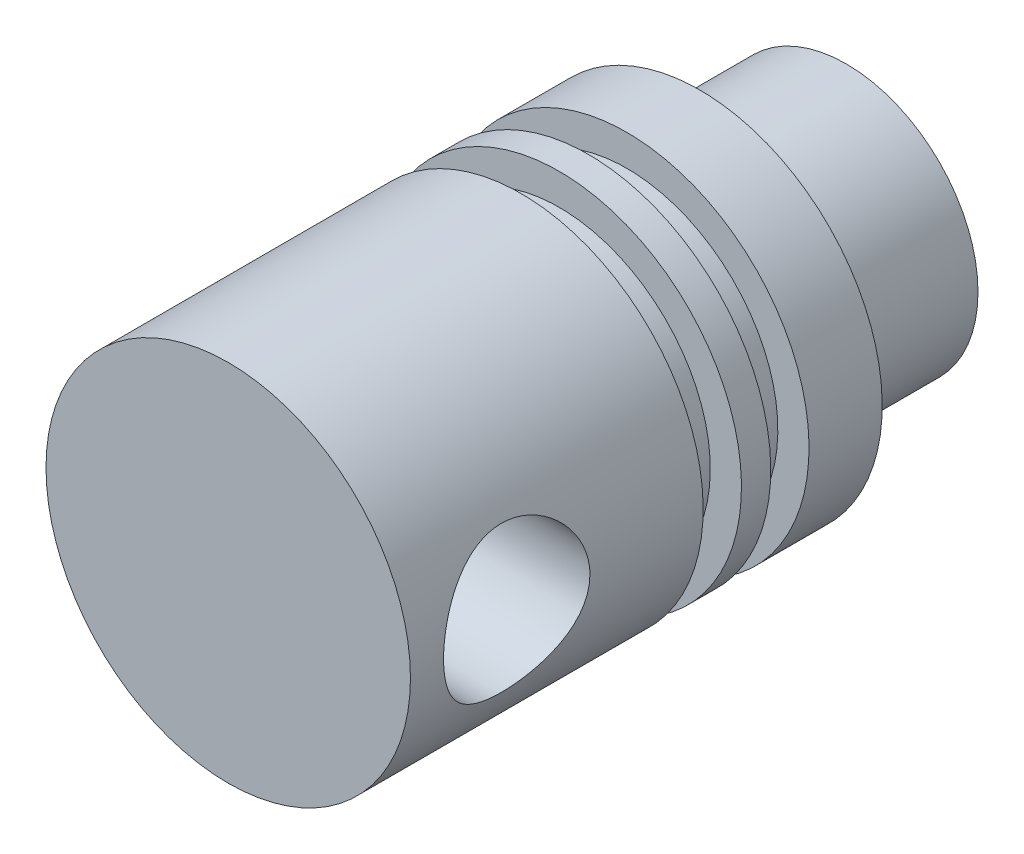
from build123d import *

# Parameters (mm, degrees)
SKETCH3_R               = 8.99487737
SKETCH3_R_2             = 5.99487737
BOSS_EXTRUDE4_DEPTH     = 10
BOSS_EXTRUDE5_START     = 15
SKETCH4_R               = 12.45
BOSS_EXTRUDE5_DEPTH     = 15
CUT_EXTRUDE1_DEPTH      = 37.727817928
CUT_EXTRUDE1_DEPTH_BACK = 37.727817928
SKETCH5_R               = 5


with BuildPart() as part:
    # Sketch2 → Revolve1 (revolve)
    with BuildSketch(Plane(origin=(0, 0, 0), x_dir=(0, 0, -1), z_dir=(1, 0, 0)), mode=Mode.PRIVATE) as revolve1_sk:
        Polygon((0, 0), (0, 12.45), (-5, 12.45), (-5, 10.32), (-7.6162, 10.32), (-7.6162, 12.45), (-9.6162, 12.45), (-9.6162, 10.32), (-12.2324, 10.32), (-12.2324, 12.45), (-17.2324, 12.45), (-17.2324, 0), align=None)
    revolve(revolve1_sk.sketch.rotate(Axis((0, 0, 17.2324), (0, 0, -1)), 180), axis=Axis((0, 0, 17.2324), (0, 0, -1)))

    # Sketch3 → Boss-Extrude4 (add)
    with BuildSketch(Plane(origin=(0, 0, 0), x_dir=(-1, 0, 0), z_dir=(0, 0, -1))):
        with Locations(Location((0, 0, 0), (0, 0, 270))):
            Circle(SKETCH3_R)
        with Locations(Location((0, 0, 0), (0, 0, 90))):
            Circle(SKETCH3_R_2, mode=Mode.SUBTRACT)
    extrude(amount=BOSS_EXTRUDE4_DEPTH)

    # Sketch4 → Boss-Extrude5 (add)
    with BuildSketch(Plane.XY.offset(17.2324).offset(BOSS_EXTRUDE5_START)):
        with Locations(Location((0, 0, 0), (0, 0, 270))):
            Circle(SKETCH4_R)
    extrude(amount=-BOSS_EXTRUDE5_DEPTH)

    # Sketch5 → Cut-Extrude1 (cut, two sides: drawn at the far end of the back side and taken through both)
    with BuildSketch(Plane(origin=(0, 0, 0), x_dir=(0, 0, -1), z_dir=(1, 0, 0)).offset(-CUT_EXTRUDE1_DEPTH_BACK)):
        with Locations((-24.968914218, 0)):
            Circle(SKETCH5_R)
    extrude(amount=CUT_EXTRUDE1_DEPTH + CUT_EXTRUDE1_DEPTH_BACK, mode=Mode.SUBTRACT)


solid = part.part
